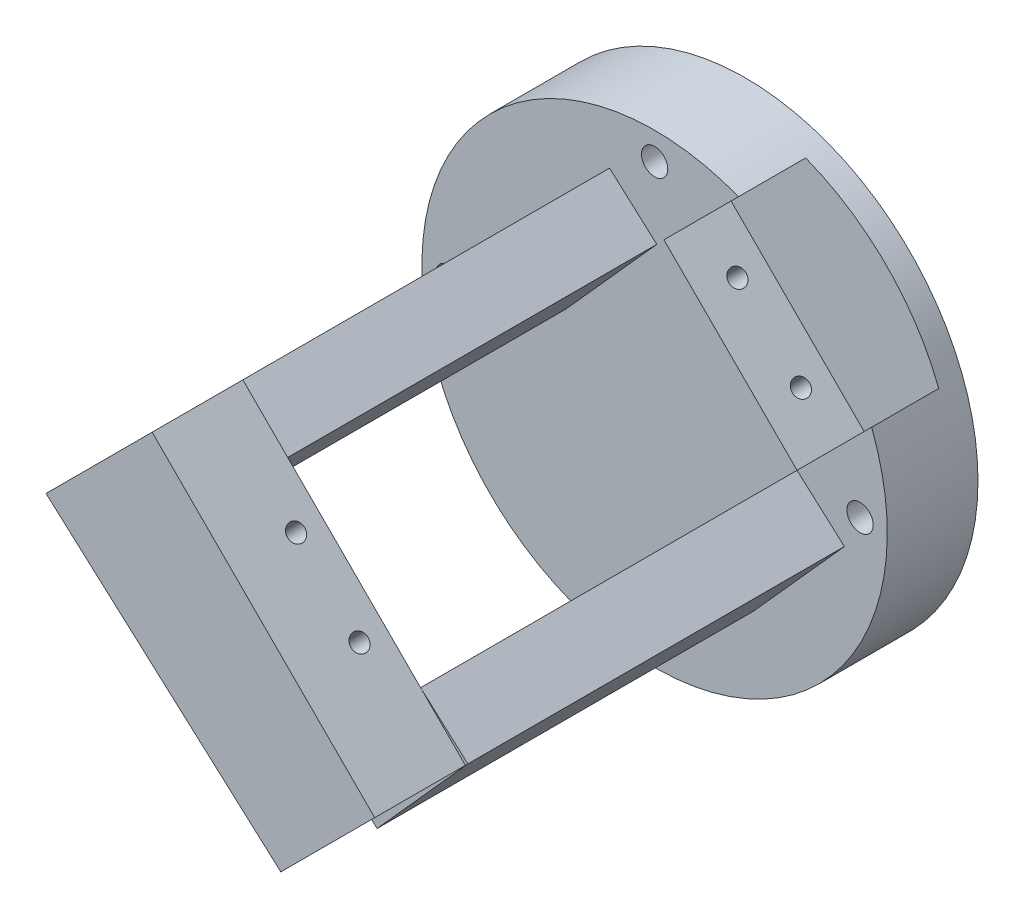
from build123d import *

# Parameters (mm, degrees)
SKETCH1_R               = 25.65
SKETCH1_R_2             = 1.45
BOSS_EXTRUDE1_DEPTH     = 10
CUT_EXTRUDE2_DEPTH      = 38.627715849
CUT_EXTRUDE2_DEPTH_BACK = 7.4
SKETCH3_R               = 0.95
CUT_EXTRUDE3_DEPTH      = 10
BOSS_EXTRUDE2_DEPTH     = 41.5
BOSS_EXTRUDE3_REACH     = 72.472
SKETCH7_R               = 0.95
SKETCH7_W               = 10
SKETCH7_H               = 34.697559569
SKETCH11_R              = 0.95
CUT_EXTRUDE4_DEPTH      = 15


with BuildPart() as part:
    # Sketch1 → Boss-Extrude1 (new body)
    with BuildSketch(Plane.XY):
        Circle(SKETCH1_R)
        with Locations((0, -22.65)):
            Circle(SKETCH1_R_2, mode=Mode.SUBTRACT)
        with Locations((22.65, 0)):
            Circle(SKETCH1_R_2, mode=Mode.SUBTRACT)
        with Locations((0, 22.65)):
            Circle(SKETCH1_R_2, mode=Mode.SUBTRACT)
        with Locations((-22.65, 0)):
            Circle(SKETCH1_R_2, mode=Mode.SUBTRACT)
    extrude(amount=BOSS_EXTRUDE1_DEPTH)

    # Sketch2 → Cut-Extrude2 (cut, two sides: drawn at the far end of the back side and taken through both)
    with BuildSketch(Plane.XY.offset(10).offset(-CUT_EXTRUDE2_DEPTH_BACK)):
        Polygon((102.061719716, 116.734185426), (9.251139978, 23.923605688), (1.028840367, 15.701306076), (15.701306076, 1.028840367), (23.923605688, 9.251139978), (116.734185426, 102.061719716), (302.355344902, 287.682879192), (287.682879192, 302.355344902), align=None)
    extrude(amount=CUT_EXTRUDE2_DEPTH + CUT_EXTRUDE2_DEPTH_BACK, mode=Mode.SUBTRACT)

    # Sketch3 → Cut-Extrude3 (cut)
    with BuildSketch(Plane(origin=(8.365073221, 8.365073221, 0), x_dir=(0, 0, -1), z_dir=(0.7071067811865477, 0.7071067811865475, 0))):
        with Locations(Location((-5.74, 4.95, 0), (0, 0, 90))):
            Circle(SKETCH3_R)
        with Locations(Location((-5.74, -4.95, 0), (0, 0, 270))):
            Circle(SKETCH3_R)
    extrude(amount=-CUT_EXTRUDE3_DEPTH, mode=Mode.SUBTRACT)

    # Sketch5 → Boss-Extrude2 (add)
    with BuildSketch(Plane.XY.offset(10)):
        Polygon((15.701306076, 1.028840367), (5.693193293, -10.144237926), (10.907296496, -14.814690558), (20.915409279, -3.641612265), align=None)
        Polygon((0.245214439, 14.873396383), (-4.968888764, 19.543849015), (-14.977001547, 8.370770723), (-9.762898344, 3.700318091), align=None)
    extrude(amount=BOSS_EXTRUDE2_DEPTH)

    # Boss-Extrude3: up to this plane
    boss_extrude3_end = Plane(origin=(5.693193293, -10.144237926, 51.5), z_dir=(0.6672075188676077, 0.7448718861432019, 0))
    # Sketch7 → Boss-Extrude3 (add, up to the surface)
    with BuildSketch(Plane(origin=(8.365073221, 8.365073221, 0), x_dir=(0, 0, -1), z_dir=(0.7071067811865477, 0.7071067811865475, 0)), mode=Mode.PRIVATE) as boss_extrude3_sk1:
        with Locations((-5.74, -4.95)):
            Circle(SKETCH7_R)
    boss_extrude3_tool1 = split(extrude(boss_extrude3_sk1.sketch, amount=-BOSS_EXTRUDE3_REACH, mode=Mode.PRIVATE), bisect_by=boss_extrude3_end, keep=Keep.BOTH, mode=Mode.PRIVATE)
    add(boss_extrude3_tool1.solids().sort_by_distance((11.865252, 4.864895, 5.74))[0])
    # Sketch7 → Boss-Extrude3 (add, up to the surface)
    with BuildSketch(Plane(origin=(8.365073221, 8.365073221, 0), x_dir=(0, 0, -1), z_dir=(0.7071067811865477, 0.7071067811865475, 0)), mode=Mode.PRIVATE) as boss_extrude3_sk2:
        with Locations((-5.74, 4.95)):
            Circle(SKETCH7_R)
    boss_extrude3_tool2 = split(extrude(boss_extrude3_sk2.sketch, amount=-BOSS_EXTRUDE3_REACH, mode=Mode.PRIVATE), bisect_by=boss_extrude3_end, keep=Keep.BOTH, mode=Mode.PRIVATE)
    add(boss_extrude3_tool2.solids().sort_by_distance((4.864895, 11.865252, 5.74))[0])
    # Sketch7 → Boss-Extrude3 (add, up to the surface)
    with BuildSketch(Plane(origin=(8.365073221, 8.365073221, 0), x_dir=(0, 0, -1), z_dir=(0.7071067811865477, 0.7071067811865475, 0)), mode=Mode.PRIVATE) as boss_extrude3_sk3:
        with Locations((-56.5, -0.015656675)):
            Rectangle(SKETCH7_W, SKETCH7_H)
        with Locations(Location((-54.39, -4.95, 0), (0, 0, 270))):
            Circle(SKETCH7_R, mode=Mode.SUBTRACT)
        with Locations(Location((-54.39, 4.95, 0), (0, 0, 270))):
            Circle(SKETCH7_R, mode=Mode.SUBTRACT)
    boss_extrude3_tool3 = split(extrude(boss_extrude3_sk3.sketch, amount=-BOSS_EXTRUDE3_REACH, mode=Mode.PRIVATE), bisect_by=boss_extrude3_end, keep=Keep.BOTH, mode=Mode.PRIVATE)
    add(boss_extrude3_tool3.solids().sort_by_distance((8.376328, 8.353818, 56.535056))[0])

    # Sketch11 → Cut-Extrude4 (cut)
    with BuildSketch(Plane(origin=(8.365073221, 8.365073221, 0), x_dir=(0, 0, -1), z_dir=(0.7071067811865477, 0.7071067811865475, 0))):
        with Locations(Location((-5.74, -4.95, 0), (0, 0, 90))):
            Circle(SKETCH11_R)
        with Locations(Location((-5.74, 4.95, 0), (0, 0, 90))):
            Circle(SKETCH11_R)
    extrude(amount=-CUT_EXTRUDE4_DEPTH, mode=Mode.SUBTRACT)


solid = part.part
